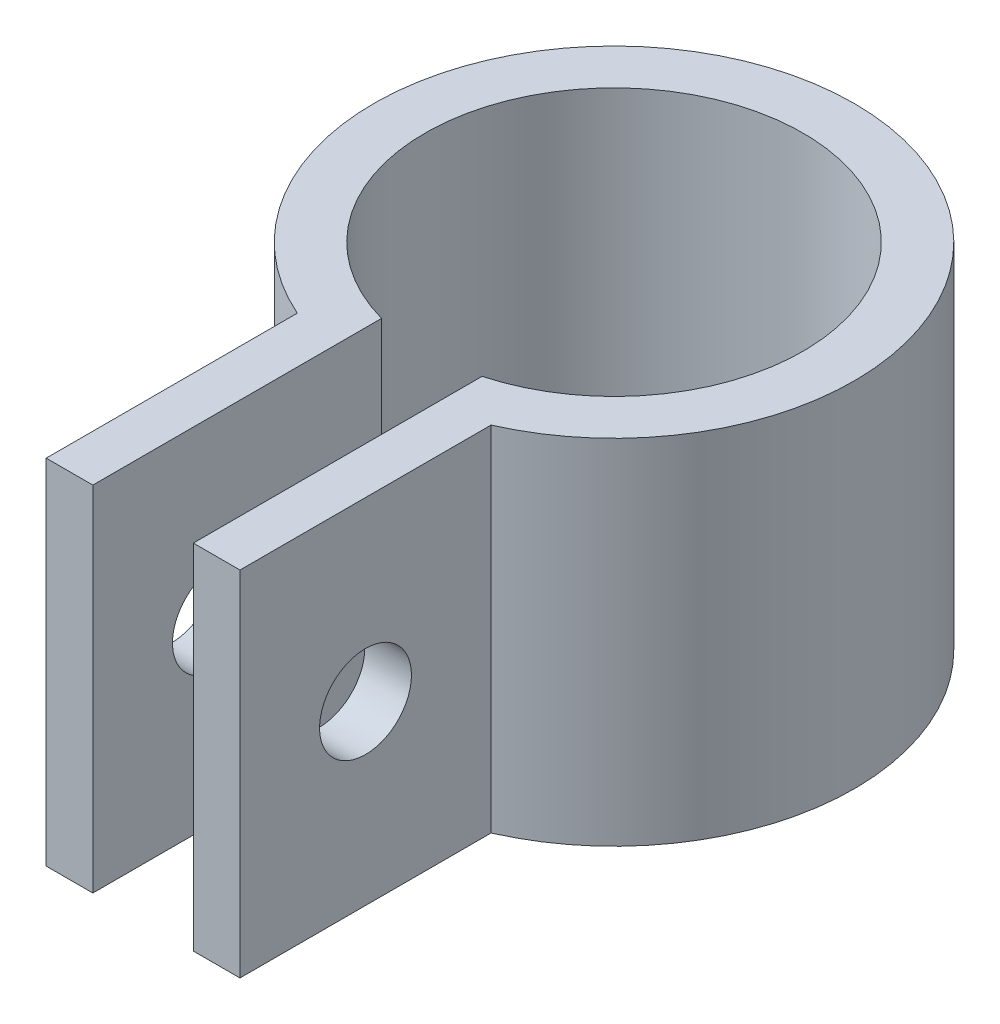
from build123d import *

# Parameters (mm, degrees)
SKETCH_1_R          = 6.8
EXTRUDE_1_DEPTH     = 10
SKETCH_3_W          = 5.484573778
SKETCH_3_H          = 13.374261712
EXTRUDE_2_DEPTH     = 10
SKETCH_2_R          = 5.35
CUT_EXTRUDE_1_DEPTH = 10
SKETCH_4_W          = 2.844022018
SKETCH_4_H          = 17.569991778
CUT_EXTRUDE_2_DEPTH = 10
SKETCH_5_R          = 1.3
CUT_EXTRUDE_3_DEPTH = 10


with BuildPart() as part:
    # 草图1 → 凸台-拉伸1 (new body)
    with BuildSketch(Plane(origin=(0, 0, 0), x_dir=(1, 0, 0), z_dir=(0, 1, 0))):
        with Locations(Location((0, 0, 0), (0, 0, 270))):
            Circle(SKETCH_1_R)
    extrude(amount=EXTRUDE_1_DEPTH)

    # 草图3 → 凸台-拉伸2 (add)
    with BuildSketch(Plane(origin=(0, 0, 0), x_dir=(1, 0, 0), z_dir=(0, 1, 0))):
        with Locations((0, -6.642082697)):
            Rectangle(SKETCH_3_W, SKETCH_3_H)
    extrude(amount=EXTRUDE_2_DEPTH)

    # 草图2 → 切除-拉伸1 (cut)
    with BuildSketch(Plane(origin=(0, 10, 0), x_dir=(1, 0, 0), z_dir=(0, 1, 0))):
        with Locations(Location((0, 0, 0), (0, 0, 270))):
            Circle(SKETCH_2_R)
    extrude(amount=-CUT_EXTRUDE_1_DEPTH, mode=Mode.SUBTRACT)

    # 草图4 → 切除-拉伸2 (cut)
    with BuildSketch(Plane(origin=(0, 0, 0), x_dir=(1, 0, 0), z_dir=(0, 1, 0))):
        with Locations((0, -13.329213553)):
            Rectangle(SKETCH_4_W, SKETCH_4_H)
    extrude(amount=CUT_EXTRUDE_2_DEPTH, mode=Mode.SUBTRACT)

    # 草图5 → 切除-拉伸3 (cut)
    with BuildSketch(Plane(origin=(2.742286889, 0, 0), x_dir=(0, 0, -1), z_dir=(1, 0, 0))):
        with Locations((-9.775871094, 5)):
            Circle(SKETCH_5_R)
    extrude(amount=-CUT_EXTRUDE_3_DEPTH, mode=Mode.SUBTRACT)


solid = part.part
